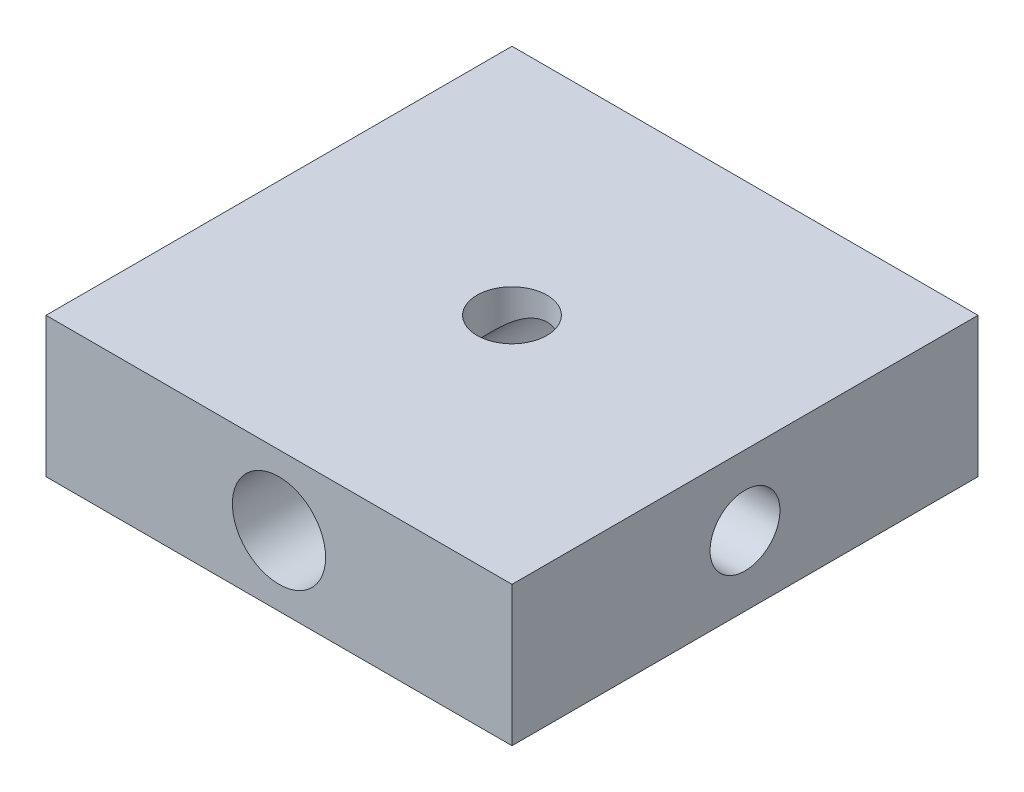
from build123d import *

# Parameters (mm, degrees)
SKETCH1_W           = 20
SKETCH1_H           = 20
BOSS_EXTRUDE1_DEPTH = 6
SKETCH2_R           = 2
CUT_EXTRUDE1_DEPTH  = 20
SKETCH3_R           = 1.5
CUT_EXTRUDE2_DEPTH  = 3
SKETCH4_R           = 1.5
CUT_EXTRUDE3_DEPTH  = 9
SKETCH5_R           = 1
CUT_EXTRUDE4_DEPTH  = 9


with BuildPart() as part:
    # Sketch1 → Boss-Extrude1 (new body)
    with BuildSketch(Plane(origin=(0, 0, 0), x_dir=(1, 0, 0), z_dir=(0, 1, 0))):
        Rectangle(SKETCH1_W, SKETCH1_H)
    extrude(amount=BOSS_EXTRUDE1_DEPTH)

    # Sketch2 → Cut-Extrude1 (cut)
    with BuildSketch(Plane.XY.offset(10)):
        with Locations((0, 3)):
            Circle(SKETCH2_R)
    extrude(amount=-CUT_EXTRUDE1_DEPTH, mode=Mode.SUBTRACT)

    # Sketch3 → Cut-Extrude2 (cut)
    with BuildSketch(Plane(origin=(0, 6, 0), x_dir=(1, 0, 0), z_dir=(0, 1, 0))):
        with Locations(Location((0, 0, 0), (0, 0, 270))):
            Circle(SKETCH3_R)
    extrude(amount=-CUT_EXTRUDE2_DEPTH, mode=Mode.SUBTRACT)

    # Sketch4 → Cut-Extrude3 (cut)
    with BuildSketch(Plane(origin=(10, 0, 0), x_dir=(0, 0, -1), z_dir=(1, 0, 0))):
        with Locations((0, 3)):
            Circle(SKETCH4_R)
    extrude(amount=-CUT_EXTRUDE3_DEPTH, mode=Mode.SUBTRACT)

    # Sketch5 → Cut-Extrude4 (cut)
    with BuildSketch(Plane.ZY.offset(10)):
        with Locations((0, 3)):
            Circle(SKETCH5_R)
    extrude(amount=-CUT_EXTRUDE4_DEPTH, mode=Mode.SUBTRACT)


solid = part.part
